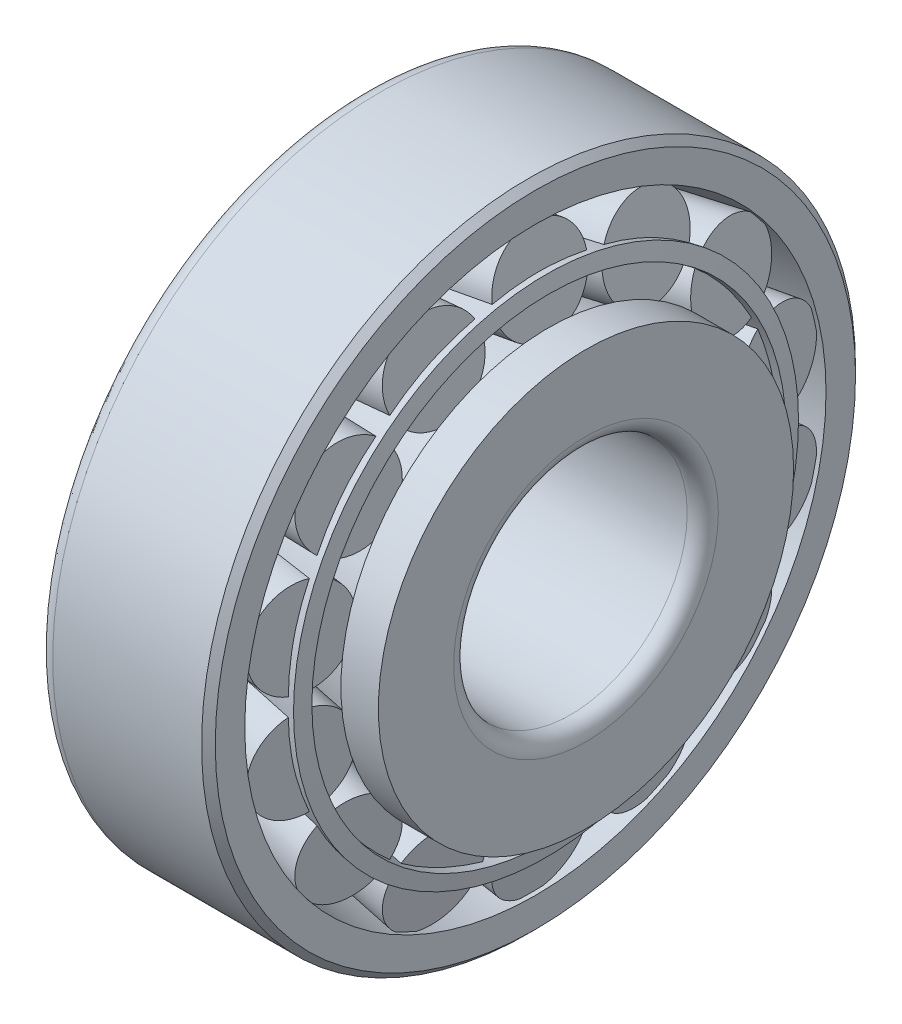
from build123d import *

# Parameters (mm, degrees)
ROLLERSDETAILED_COUNT = 14
ROLLERSDETAILED_ANGLE = 334.285714286


with BuildPart() as part:
    # OutRacSke → OuterRace (revolve)
    with BuildSketch(Plane.XY, mode=Mode.PRIVATE) as outerrace_sk:
        with BuildLine():
            Line((-3.25, 18.664802045), (-14.25, 16.636))
            Line((-14.25, 16.636), (-14.25, 20))
            ThreePointArc((-14.25, 20), (-13.957106781, 20.707106781), (-13.25, 21))
            Line((-13.25, 21), (-3.69, 21))
            Line((-3.69, 21), (-3.25, 20.56))
            Line((-3.25, 20.56), (-3.25, 18.664802045))
        make_face()
    revolve(outerrace_sk.sketch.rotate(Axis((-42.5, 0, 0), (1, 0, 0)), 270), axis=Axis((-42.5, 0, 0), (1, 0, 0)))

    # RolDetSke → RollerDetailed (revolve)
    with BuildSketch(Plane.XY):
        Polygon((-12.699066134, 13.917420032), (-13.25, 16.904538732), (-3.51420572, 18.700175036), (-2.963271854, 15.713056336), align=None)
    rollerdetailed = revolve(axis=Axis((-38.307222932, 9.194339953, 0), (0.9834135636447757, 0.1813774044347389, 0)))

    # RollersDetailed: RollerDetailed ×14 about axis
    rollersdetailed_axis = Axis((-50, 0, 0), (1, 0, 0))
    for i in range(1, ROLLERSDETAILED_COUNT):
        add(rollerdetailed.rotate(rollersdetailed_axis, i * ROLLERSDETAILED_ANGLE / (ROLLERSDETAILED_COUNT - 1)))

    # InsRacSke → InnerRace (revolve)
    with BuildSketch(Plane.XY, mode=Mode.PRIVATE) as innerrace_sk:
        with BuildLine():
            Line((-12.198645533, 11.234051333), (-13, 11.234051333))
            Line((-13, 11.234051333), (-13, 7.94))
            Line((-13, 7.94), (-12.56, 7.5))
            Line((-12.56, 7.5), (-1, 7.5))
            ThreePointArc((-1, 7.5), (-0.292893219, 7.792893219), (0, 8.5))
            Line((0, 8.5), (0, 13.333437637))
            Line((0, 13.333437637), (-2.406828651, 13.333437637))
            Line((-2.406828651, 13.333437637), (-2.406828651, 12.725937637))
            Line((-2.406828651, 12.725937637), (-12.142622931, 10.930301333))
            Line((-12.142622931, 10.930301333), (-12.198645533, 11.234051333))
        make_face()
    revolve(innerrace_sk.sketch.rotate(Axis((-42.5, 0, 0), (1, 0, 0)), 270), axis=Axis((-42.5, 0, 0), (1, 0, 0)))

    # CagSpiSke → CageSpine (revolve)
    with BuildSketch(Plane.XY, mode=Mode.PRIVATE) as cagespine_sk:
        with BuildLine():
            Line((-2.568304452, 16.216589085), (-12.790888446, 14.331170966))
            ThreePointArc((-12.790888446, 14.331170966), (-13.376142574, 13.951828201), (-13.521743896, 13.269755197))
            Line((-13.521743896, 13.269755197), (-13.374828198, 12.47319021))
            Line((-13.374828198, 12.47319021), (-12.379121965, 12.656834832))
            Line((-12.379121965, 12.656834832), (-12.5076732, 13.353829195))
            Line((-12.5076732, 13.353829195), (-2.38465983, 15.220882852))
            Line((-2.38465983, 15.220882852), (-2.568304452, 16.216589085))
        make_face()
    revolve(cagespine_sk.sketch.rotate(Axis((-42.5, 0, 0), (1, 0, 0)), 81.353090543), axis=Axis((-42.5, 0, 0), (1, 0, 0)))


solid = part.part
